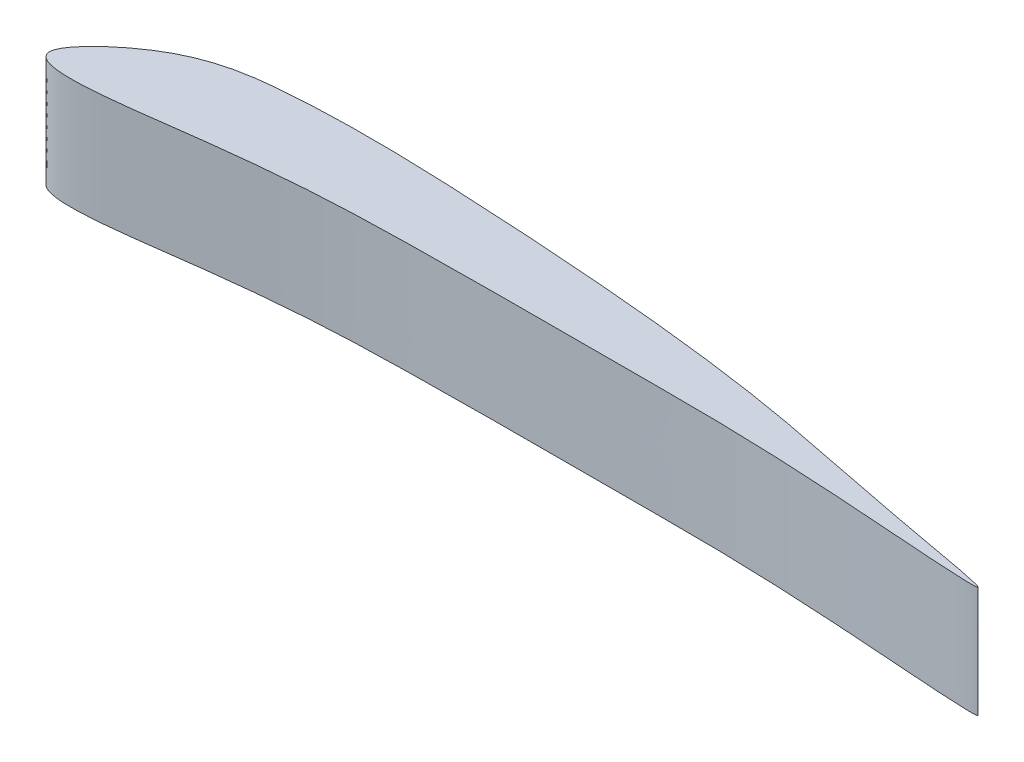
from build123d import *

# Parameters (mm, degrees)
BOSS_EXTRUDE1_DEPTH = 12


with BuildPart() as part:
    # Sketch1 → Boss-Extrude1 (new body)
    with BuildSketch(Plane(origin=(0, 0, 0), x_dir=(1, 0, 0), z_dir=(0, 1, 0))):
        with BuildLine():
            add(Edge.make_bspline(
                [(100, 0), (99.345231917, 0.276820733), (85.262627049, 2.699279426), (68.739172597, 6.557996207), (41.873219962, 8.724369046), (19.443483023, 9.481163982), (6.80706733, 7.64824681), (-4.767400279, -3.264154704), (20.110659344, 0.607873235), (35.117280697, 1.441311521), (62.865803217, 1.352305678), (77.460559586, 1.484803675), (101.122990872, -0.474774449), (100, 0)],
                knots=[0, 0, 0, 0, 0.040322896, 0.143748372, 0.307747437, 0.413694398, 0.470412693, 0.50833063, 0.578615377, 0.681874535, 0.809073771, 0.930842315, 1, 1, 1, 1], degree=3))
        make_face()
    extrude(amount=BOSS_EXTRUDE1_DEPTH)


solid = part.part
